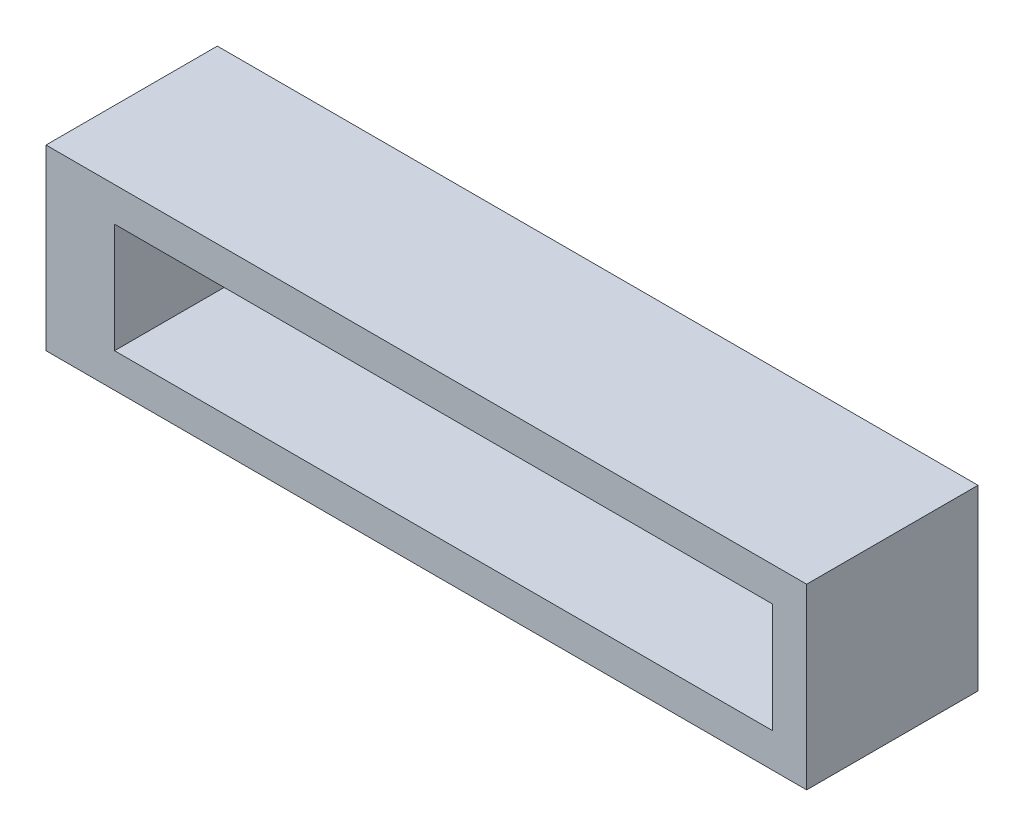
from build123d import *

# Parameters (mm, degrees)
SKICA1_W                = 22.2
SKICA1_H                = 5.2
SKICA1_W_2              = 19.2
SKICA1_H_2              = 3.2
P_IDAT_VYSUNUT_M1_DEPTH = 5


with BuildPart() as part:
    # Skica1 → Přidat vysunutím1 (new body)
    with BuildSketch(Plane.XY):
        with Locations((11.1, 2.6)):
            Rectangle(SKICA1_W, SKICA1_H)
        with Locations((11.6, 2.6)):
            Rectangle(SKICA1_W_2, SKICA1_H_2, mode=Mode.SUBTRACT)
    extrude(amount=P_IDAT_VYSUNUT_M1_DEPTH)


solid = part.part
